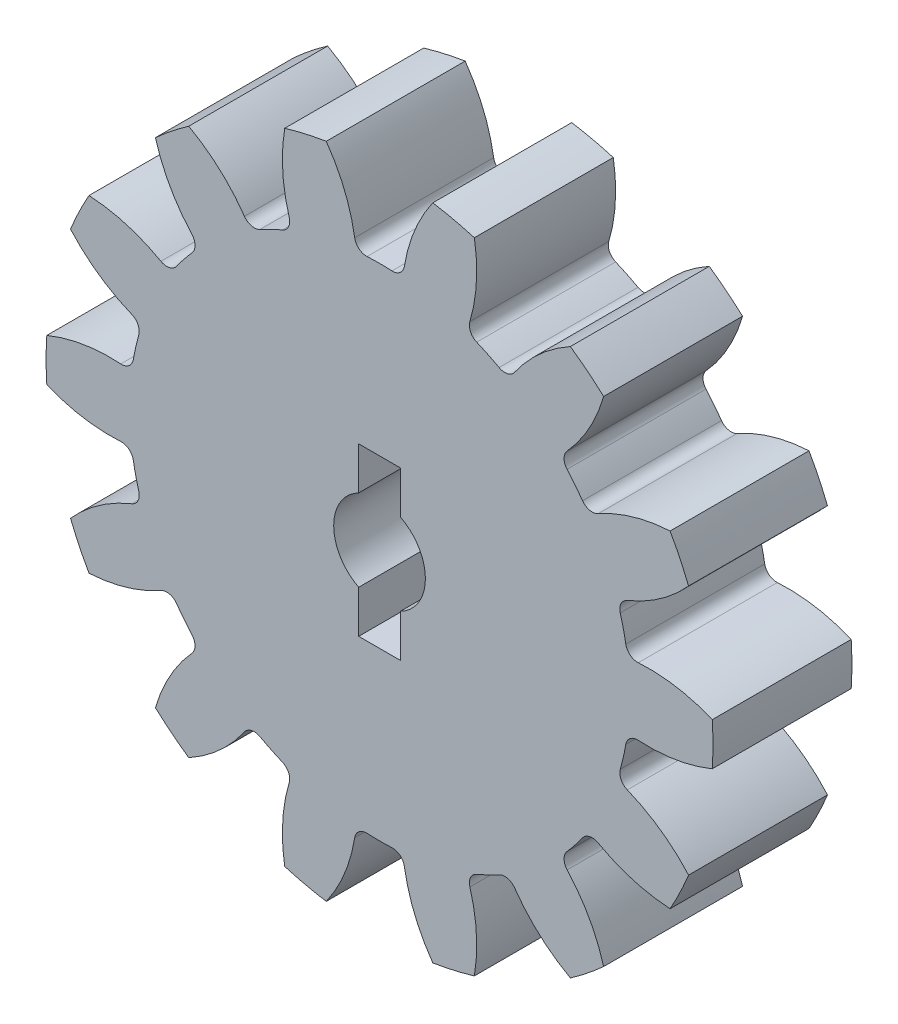
from build123d import *

# Parameters (mm, degrees)
SKETCH1_R                      = 12
BOSS_EXTRUDE1_DEPTH            = 2.5
CUT_EXTRUDE1_DEPTH             = 18.153716798
FILLET2_R                      = 0.43
CIRPATTERN1_COUNT              = 14
FILLET2_OF_CIRPATTERN1_R       = 0.43
THROUGH_CENTER_HOLE_DEPTH      = 18.046206741
THROUGH_CENTER_HOLE_DEPTH_BACK = 18.046206741


with BuildPart() as part:
    # Sketch1 → Boss-Extrude1 (new, symmetric)
    with BuildSketch(Plane.XY):
        Circle(SKETCH1_R)
    extrude(amount=BOSS_EXTRUDE1_DEPTH, both=True)

    # Sketch3 → Cut-Extrude1 (cut, symmetric)
    with BuildSketch(Plane.XY):
        with BuildLine():
            ThreePointArc((1.917509067, 11.845807654), (1.190322396, 10.473907615), (0.843805856, 8.960356671))
            ThreePointArc((0.843805856, 8.960356671), (0, 9), (-0.843805856, 8.960356671))
            ThreePointArc((-0.843805856, 8.960356671), (-1.190322396, 10.473907615), (-1.917509067, 11.845807654))
            ThreePointArc((-1.917509067, 11.845807654), (0, 12), (1.917509067, 11.845807654))
        make_face()
    cut_extrude1 = extrude(amount=CUT_EXTRUDE1_DEPTH, both=True, mode=Mode.SUBTRACT)

    # Fillet2
    fillet2_edges = [part.edges().sort_by_distance(p)[0] for p in [
        (-0.843805856, 8.960356671, 0),
        (0.843805856, 8.960356671, 0),
    ]]
    fillet(fillet2_edges, radius=FILLET2_R)

    # CirPattern1: Cut-Extrude1 ×14 about axis
    cirpattern1_axis = Axis((0, 0, 0), (0, 0, 1))
    for i in range(1, CIRPATTERN1_COUNT):
        add(cut_extrude1.rotate(cirpattern1_axis, i * 360 / CIRPATTERN1_COUNT), mode=Mode.SUBTRACT)

    # Fillet2 of CirPattern1
    fillet2_of_cirpattern1_edges = [part.edges().sort_by_distance(p)[0] for p in [
        (-4.647995863, 7.706888766, 0),
        (-3.12751025, 8.439116046, 0),
        (-7.531593286, 4.926977022, 0),
        (-6.479384594, 6.246404989, 0),
        (-8.923466289, 1.171217054, 0),
        (-8.547937355, 2.816516817, 0),
        (-8.547937355, -2.816516817, 0),
        (-8.923466289, -1.171217054, 0),
        (-6.479384594, -6.246404989, 0),
        (-7.531593286, -4.926977022, 0),
        (-3.12751025, -8.439116046, 0),
        (-4.647995863, -7.706888766, 0),
        (0.843805856, -8.960356671, 0),
        (-0.843805856, -8.960356671, 0),
        (4.647995863, -7.706888766, 0),
        (3.12751025, -8.439116046, 0),
        (7.531593286, -4.926977022, 0),
        (6.479384594, -6.246404989, 0),
        (8.923466289, -1.171217054, 0),
        (8.547937355, -2.816516817, 0),
        (8.547937355, 2.816516817, 0),
        (8.923466289, 1.171217054, 0),
        (6.479384594, 6.246404989, 0),
        (7.531593286, 4.926977022, 0),
        (3.12751025, 8.439116046, 0),
        (4.647995863, 7.706888766, 0),
    ]]
    fillet(fillet2_of_cirpattern1_edges, radius=FILLET2_OF_CIRPATTERN1_R)

    # Sketch4 → Through_Center_Hole (cut, two sides: drawn at the far end of the back side and taken through both)
    with BuildSketch(Plane.XY.offset(-THROUGH_CENTER_HOLE_DEPTH_BACK)):
        with BuildLine():
            Line((-0.75, 3), (0.75, 3))
            Line((0.75, 3), (0.75, 1.469693846))
            ThreePointArc((0.75, 1.469693846), (1.65, 0), (0.75, -1.469693846))
            Line((0.75, -1.469693846), (0.75, -3))
            Line((0.75, -3), (-0.75, -3))
            Line((-0.75, -3), (-0.75, -1.469693846))
            ThreePointArc((-0.75, -1.469693846), (-1.65, 0), (-0.75, 1.469693846))
            Line((-0.75, 1.469693846), (-0.75, 3))
        make_face()
    extrude(amount=THROUGH_CENTER_HOLE_DEPTH + THROUGH_CENTER_HOLE_DEPTH_BACK, mode=Mode.SUBTRACT)


solid = part.part
